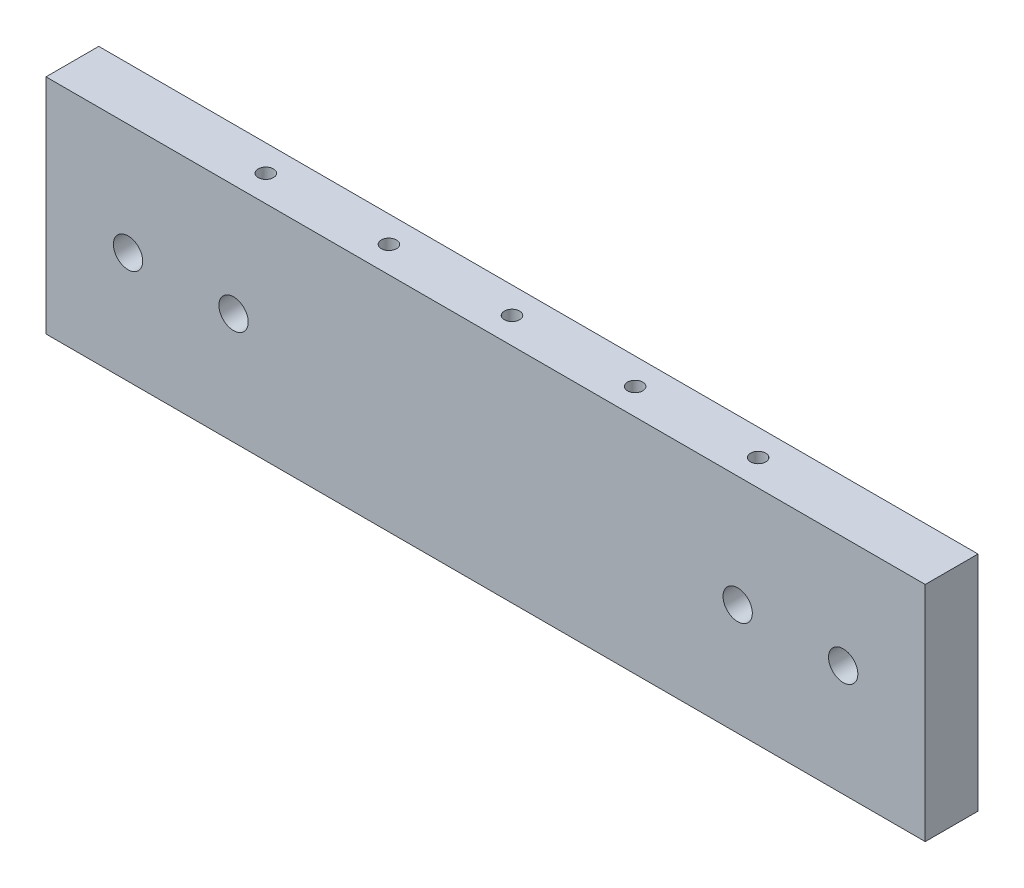
from build123d import *

# Parameters (mm, degrees)
SKETCH_1_W               = 150
SKETCH_1_H               = 38
EXTRUDE_1_DEPTH          = 9
SKETCH_2_R               = 1.3
CUT_EXTRUDE_1_DEPTH      = 8
PATTERN_LINEAR_1_COUNT   = 5
PATTERN_LINEAR_1_PITCH   = 21
MIRROR_1_COPY_1_SKETCH_R = 1.3
MIRROR_1_COPY_1_DEPTH    = 8
MIRROR_1_COPY_2_SKETCH_R = 1.3
MIRROR_1_COPY_2_DEPTH    = 8
MIRROR_1_COPY_3_SKETCH_R = 1.3
MIRROR_1_COPY_3_DEPTH    = 8
MIRROR_1_COPY_4_SKETCH_R = 1.3
MIRROR_1_COPY_4_DEPTH    = 8
CUT_EXTRUDE_2_REACH      = 79.891
SKETCH_3_R               = 2.5


with BuildPart() as part:
    # 草圖1 → 填料-伸長1 (new body)
    with BuildSketch(Plane.XY):
        Rectangle(SKETCH_1_W, SKETCH_1_H)
    extrude(amount=EXTRUDE_1_DEPTH)

    # 草圖2 → 除料-伸長1 (cut)
    with BuildSketch(Plane(origin=(0, 19, 0), x_dir=(1, 0, 0), z_dir=(0, 1, 0))):
        with Locations(Location((-42, -4.5, 0), (0, 0, 270))):
            Circle(SKETCH_2_R)
    cut_extrude_1 = extrude(amount=-CUT_EXTRUDE_1_DEPTH, mode=Mode.SUBTRACT)

    # 直線複製排列1: 除料-伸長1 ×5
    with Locations(*[(i * PATTERN_LINEAR_1_PITCH, 0, 0) for i in range(1, PATTERN_LINEAR_1_COUNT)]):
        add(cut_extrude_1, mode=Mode.SUBTRACT)

    # 鏡射1: 除料-伸長1 across plane
    add(cut_extrude_1.mirror(Plane.ZX), mode=Mode.SUBTRACT)

    # 鏡射1 copy 1 sketch → 鏡射1 copy 1 (cut)
    with BuildSketch(Plane(origin=(21, -19, 0), x_dir=(1, 0, 0), z_dir=(0, -1, 0))):
        with Locations((-42, 4.5)):
            Circle(MIRROR_1_COPY_1_SKETCH_R)
    extrude(amount=-MIRROR_1_COPY_1_DEPTH, mode=Mode.SUBTRACT)

    # 鏡射1 copy 2 sketch → 鏡射1 copy 2 (cut)
    with BuildSketch(Plane(origin=(42, -19, 0), x_dir=(1, 0, 0), z_dir=(0, -1, 0))):
        with Locations((-42, 4.5)):
            Circle(MIRROR_1_COPY_2_SKETCH_R)
    extrude(amount=-MIRROR_1_COPY_2_DEPTH, mode=Mode.SUBTRACT)

    # 鏡射1 copy 3 sketch → 鏡射1 copy 3 (cut)
    with BuildSketch(Plane(origin=(63, -19, 0), x_dir=(1, 0, 0), z_dir=(0, -1, 0))):
        with Locations((-42, 4.5)):
            Circle(MIRROR_1_COPY_3_SKETCH_R)
    extrude(amount=-MIRROR_1_COPY_3_DEPTH, mode=Mode.SUBTRACT)

    # 鏡射1 copy 4 sketch → 鏡射1 copy 4 (cut)
    with BuildSketch(Plane(origin=(84, -19, 0), x_dir=(1, 0, 0), z_dir=(0, -1, 0))):
        with Locations((-42, 4.5)):
            Circle(MIRROR_1_COPY_4_SKETCH_R)
    extrude(amount=-MIRROR_1_COPY_4_DEPTH, mode=Mode.SUBTRACT)

    # 草圖3 → 除料-伸長2 (cut, up to next)
    with BuildSketch(Plane.XY.offset(9), mode=Mode.PRIVATE) as cut_extrude_2_sk1:
        with Locations((-61, 0)):
            Circle(SKETCH_3_R)
    cut_extrude_2_tool1 = extrude(cut_extrude_2_sk1.sketch, amount=-CUT_EXTRUDE_2_REACH, mode=Mode.PRIVATE) & part.part
    # 草圖3 → 除料-伸長2 (cut, up to next)
    with BuildSketch(Plane.XY.offset(9), mode=Mode.PRIVATE) as cut_extrude_2_sk2:
        with Locations((-43, 0)):
            Circle(SKETCH_3_R)
    cut_extrude_2_tool2 = extrude(cut_extrude_2_sk2.sketch, amount=-CUT_EXTRUDE_2_REACH, mode=Mode.PRIVATE) & part.part
    cut_extrude_2_1 = cut_extrude_2_tool1.solids().sort_by_distance((-61, 0, 9))[0]
    add(cut_extrude_2_1, mode=Mode.SUBTRACT)
    cut_extrude_2_2 = cut_extrude_2_tool2.solids().sort_by_distance((-43, 0, 9))[0]
    add(cut_extrude_2_2, mode=Mode.SUBTRACT)
    cut_extrude_2 = cut_extrude_2_1 + cut_extrude_2_2  # 除料-伸長2 as one shape, for the pattern or mirror that repeats it

    # 鏡射2: 除料-伸長2 across plane
    add(cut_extrude_2.mirror(Plane(origin=(0, 0, 0), x_dir=(0, 0, 1), z_dir=(1, 0, 0))), mode=Mode.SUBTRACT)


solid = part.part
